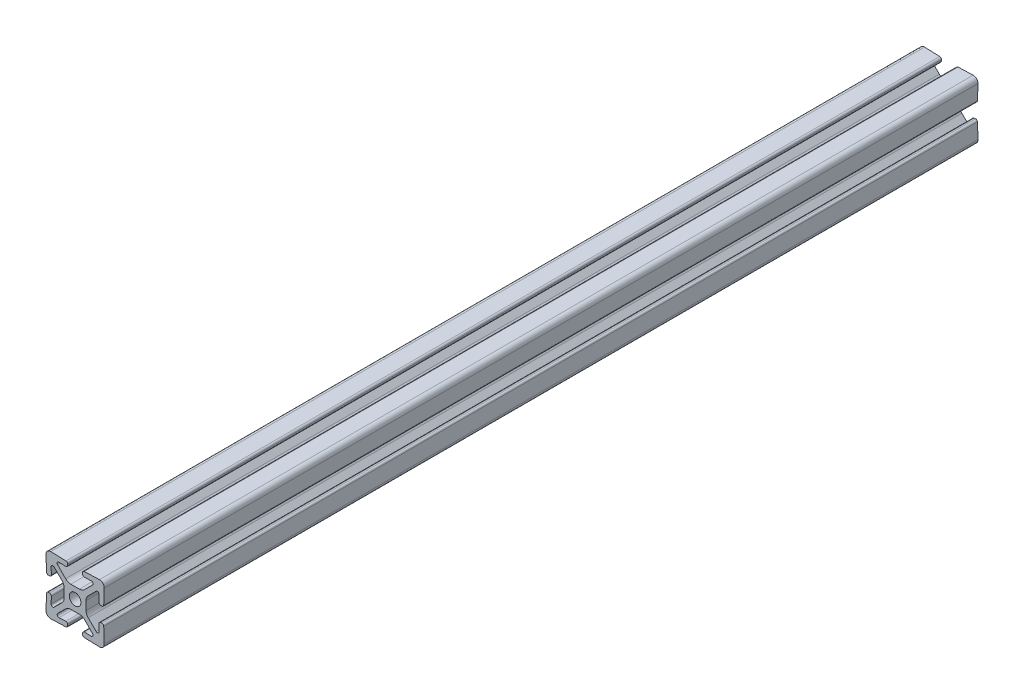
from build123d import *

# Parameters (mm, degrees)
BOSS_EXTRUDE1_DEPTH = 609.6
CIRPATTERN1_COUNT   = 4
CUT_EXTRUDE1_DEPTH  = 838.2


with BuildPart() as part:
    # Sketch3 → Boss-Extrude1 (new, symmetric)
    with BuildSketch(Plane.XY):
        with BuildLine():
            Line((0, 4.7625), (-1.884807374, 4.7625))
            ThreePointArc((-1.884807374, 4.7625), (-3.099827272, 5.004182484), (-4.129871405, 5.69243597))
            Line((-4.129871405, 5.69243597), (-7.599623114, 9.162187679))
            ThreePointArc((-7.599623114, 9.162187679), (-7.759888701, 10.006330839), (-7.033220609, 10.464824259))
            Line((-7.033220609, 10.464824259), (-4.047481702, 10.360559959))
            ThreePointArc((-4.047481702, 10.360559959), (-3.501205536, 10.564804249), (-3.259352476, 11.095502353))
            Line((-3.259352476, 11.095502353), (-3.23896419, 11.679346474))
            ThreePointArc((-3.23896419, 11.679346474), (-3.443208479, 12.225622641), (-3.973906584, 12.467475701))
            Line((-3.973906584, 12.467475701), (-10.597084223, 12.698762161))
            ThreePointArc((-10.597084223, 12.698762161), (-12.104840979, 12.104840979), (-12.698762161, 10.597084223))
            Line((-12.698762161, 10.597084223), (-12.467475701, 3.973906584))
            ThreePointArc((-12.467475701, 3.973906584), (-12.225622641, 3.443208479), (-11.679346474, 3.23896419))
            Line((-11.679346474, 3.23896419), (-11.095502353, 3.259352476))
            ThreePointArc((-11.095502353, 3.259352476), (-10.564804249, 3.501205536), (-10.360559959, 4.047481702))
            Line((-10.360559959, 4.047481702), (-10.464824259, 7.033220609))
            ThreePointArc((-10.464824259, 7.033220609), (-10.006330839, 7.759888701), (-9.162187679, 7.599623114))
            Line((-9.162187679, 7.599623114), (-5.69243597, 4.129871405))
            ThreePointArc((-5.69243597, 4.129871405), (-5.004182484, 3.099827272), (-4.7625, 1.884807374))
            Line((-4.7625, 1.884807374), (-4.7625, 0))
            Line((-4.7625, 0), (-2.54, 0))
            ThreePointArc((-2.54, 0), (-1.796051224, 1.796051224), (0, 2.54))
            Line((0, 2.54), (0, 4.7625))
        make_face()
    boss_extrude1 = extrude(amount=BOSS_EXTRUDE1_DEPTH, both=True)

    # CirPattern1: Boss-Extrude1 ×4 about axis
    cirpattern1_axis = Axis((0, 0, 0), (0, 0, 1))
    for i in range(1, CIRPATTERN1_COUNT):
        add(boss_extrude1.rotate(cirpattern1_axis, i * 360 / CIRPATTERN1_COUNT))

    # Sketch4 → Cut-Extrude1 (cut)
    with BuildSketch(Plane.XY.offset(609.6)):
        with BuildLine():
            Line((1.884807374, 4.7625), (-1.884807374, 4.7625))
            ThreePointArc((-1.884807374, 4.7625), (-3.099827272, 5.004182484), (-4.129871405, 5.69243597))
            Line((-4.129871405, 5.69243597), (-7.599623114, 9.162187679))
            ThreePointArc((-7.599623114, 9.162187679), (-7.759888701, 10.006330839), (-7.033220609, 10.464824259))
            Line((-7.033220609, 10.464824259), (-4.047481702, 10.360559959))
            ThreePointArc((-4.047481702, 10.360559959), (-3.501205536, 10.564804249), (-3.259352476, 11.095502353))
            Line((-3.259352476, 11.095502353), (-3.23896419, 11.679346474))
            ThreePointArc((-3.23896419, 11.679346474), (-3.443208479, 12.225622641), (-3.973906584, 12.467475701))
            Line((-3.973906584, 12.467475701), (-10.597084223, 12.698762161))
            ThreePointArc((-10.597084223, 12.698762161), (-12.104840979, 12.104840979), (-12.698762161, 10.597084223))
            Line((-12.698762161, 10.597084223), (-12.467475701, 3.973906584))
            ThreePointArc((-12.467475701, 3.973906584), (-12.225622641, 3.443208479), (-11.679346474, 3.23896419))
            Line((-11.679346474, 3.23896419), (-11.095502353, 3.259352476))
            ThreePointArc((-11.095502353, 3.259352476), (-10.564804249, 3.501205536), (-10.360559959, 4.047481702))
            Line((-10.360559959, 4.047481702), (-10.464824259, 7.033220609))
            ThreePointArc((-10.464824259, 7.033220609), (-10.006330839, 7.759888701), (-9.162187679, 7.599623114))
            Line((-9.162187679, 7.599623114), (-5.69243597, 4.129871405))
            ThreePointArc((-5.69243597, 4.129871405), (-5.004182484, 3.099827272), (-4.7625, 1.884807374))
            Line((-4.7625, 1.884807374), (-4.7625, -1.884807374))
            ThreePointArc((-4.7625, -1.884807374), (-5.004182484, -3.099827272), (-5.69243597, -4.129871405))
            Line((-5.69243597, -4.129871405), (-9.162187679, -7.599623114))
            ThreePointArc((-9.162187679, -7.599623114), (-10.006330839, -7.759888701), (-10.464824259, -7.033220609))
            Line((-10.464824259, -7.033220609), (-10.360559959, -4.047481702))
            ThreePointArc((-10.360559959, -4.047481702), (-10.564804249, -3.501205536), (-11.095502353, -3.259352476))
            Line((-11.095502353, -3.259352476), (-11.679346474, -3.23896419))
            ThreePointArc((-11.679346474, -3.23896419), (-12.225622641, -3.443208479), (-12.467475701, -3.973906584))
            Line((-12.467475701, -3.973906584), (-12.698762161, -10.597084223))
            ThreePointArc((-12.698762161, -10.597084223), (-12.104840979, -12.104840979), (-10.597084223, -12.698762161))
            Line((-10.597084223, -12.698762161), (-3.973906584, -12.467475701))
            ThreePointArc((-3.973906584, -12.467475701), (-3.443208479, -12.225622641), (-3.23896419, -11.679346474))
            Line((-3.23896419, -11.679346474), (-3.259352476, -11.095502353))
            ThreePointArc((-3.259352476, -11.095502353), (-3.501205536, -10.564804249), (-4.047481702, -10.360559959))
            Line((-4.047481702, -10.360559959), (-7.033220609, -10.464824259))
            ThreePointArc((-7.033220609, -10.464824259), (-7.759888701, -10.006330839), (-7.599623114, -9.162187679))
            Line((-7.599623114, -9.162187679), (-4.129871405, -5.69243597))
            ThreePointArc((-4.129871405, -5.69243597), (-3.099827272, -5.004182484), (-1.884807374, -4.7625))
            Line((-1.884807374, -4.7625), (1.884807374, -4.7625))
            ThreePointArc((1.884807374, -4.7625), (3.099827272, -5.004182484), (4.129871405, -5.69243597))
            Line((4.129871405, -5.69243597), (7.599623114, -9.162187679))
            ThreePointArc((7.599623114, -9.162187679), (7.759888701, -10.006330839), (7.033220609, -10.464824259))
            Line((7.033220609, -10.464824259), (4.047481702, -10.360559959))
            ThreePointArc((4.047481702, -10.360559959), (3.501205536, -10.564804249), (3.259352476, -11.095502353))
            Line((3.259352476, -11.095502353), (3.23896419, -11.679346474))
            ThreePointArc((3.23896419, -11.679346474), (3.443208479, -12.225622641), (3.973906584, -12.467475701))
            Line((3.973906584, -12.467475701), (10.597084223, -12.698762161))
            ThreePointArc((10.597084223, -12.698762161), (12.104840979, -12.104840979), (12.698762161, -10.597084223))
            Line((12.698762161, -10.597084223), (12.467475701, -3.973906584))
            ThreePointArc((12.467475701, -3.973906584), (12.225622641, -3.443208479), (11.679346474, -3.23896419))
            Line((11.679346474, -3.23896419), (11.095502353, -3.259352476))
            ThreePointArc((11.095502353, -3.259352476), (10.564804249, -3.501205536), (10.360559959, -4.047481702))
            Line((10.360559959, -4.047481702), (10.464824259, -7.033220609))
            ThreePointArc((10.464824259, -7.033220609), (10.006330839, -7.759888701), (9.162187679, -7.599623114))
            Line((9.162187679, -7.599623114), (5.69243597, -4.129871405))
            ThreePointArc((5.69243597, -4.129871405), (5.004182484, -3.099827272), (4.7625, -1.884807374))
            Line((4.7625, -1.884807374), (4.7625, 1.884807374))
            ThreePointArc((4.7625, 1.884807374), (5.004182484, 3.099827272), (5.69243597, 4.129871405))
            Line((5.69243597, 4.129871405), (9.162187679, 7.599623114))
            ThreePointArc((9.162187679, 7.599623114), (10.006330839, 7.759888701), (10.464824259, 7.033220609))
            Line((10.464824259, 7.033220609), (10.360559959, 4.047481702))
            ThreePointArc((10.360559959, 4.047481702), (10.564804249, 3.501205536), (11.095502353, 3.259352476))
            Line((11.095502353, 3.259352476), (11.679346474, 3.23896419))
            ThreePointArc((11.679346474, 3.23896419), (12.225622641, 3.443208479), (12.467475701, 3.973906584))
            Line((12.467475701, 3.973906584), (12.698762161, 10.597084223))
            ThreePointArc((12.698762161, 10.597084223), (12.104840979, 12.104840979), (10.597084223, 12.698762161))
            Line((10.597084223, 12.698762161), (3.973906584, 12.467475701))
            ThreePointArc((3.973906584, 12.467475701), (3.443208479, 12.225622641), (3.23896419, 11.679346474))
            Line((3.23896419, 11.679346474), (3.259352476, 11.095502353))
            ThreePointArc((3.259352476, 11.095502353), (3.501205536, 10.564804249), (4.047481702, 10.360559959))
            Line((4.047481702, 10.360559959), (7.033220609, 10.464824259))
            ThreePointArc((7.033220609, 10.464824259), (7.759888701, 10.006330839), (7.599623114, 9.162187679))
            Line((7.599623114, 9.162187679), (4.129871405, 5.69243597))
            ThreePointArc((4.129871405, 5.69243597), (3.099827272, 5.004182484), (1.884807374, 4.7625))
        make_face()
    extrude(amount=-CUT_EXTRUDE1_DEPTH, mode=Mode.SUBTRACT)


solid = part.part
